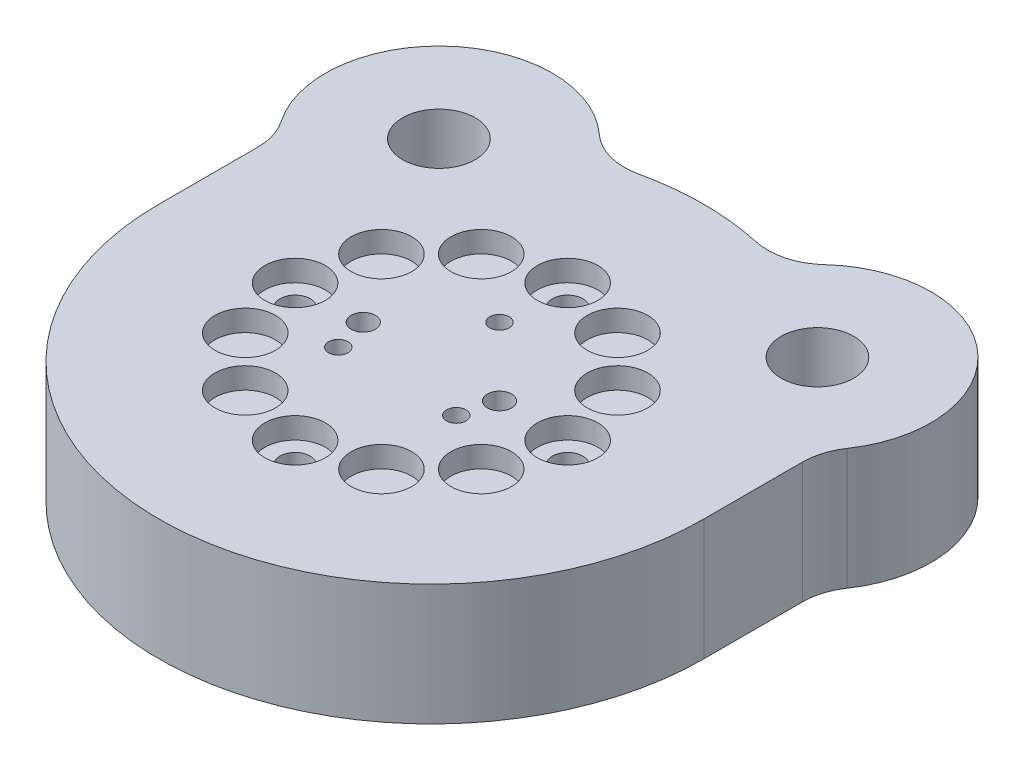
from build123d import *

# Parameters (mm, degrees)
BOSS_EXTRUDE1_DEPTH                                 = 40
FILLET1_R                                           = 20
CUT_EXTRUDE2_REACH                                  = 150.682
SKETCH3_R                                           = 12
SKETCH4_R                                           = 10
CUT_EXTRUDE3_DEPTH                                  = 7
CIRPATTERN1_COUNT                                   = 12
F_10_0_10_DIAMETER_HOLE1_D                          = 10
SKETCH8_R                                           = 8.5
CUT_EXTRUDE4_DEPTH                                  = 23
CBORE_FOR_M6_HEX_SOCKET_HEAD_CAP_SCREW1_D           = 6.4
CBORE_FOR_M6_HEX_SOCKET_HEAD_CAP_SCREW1_CBORE_D     = 11
CBORE_FOR_M6_HEX_SOCKET_HEAD_CAP_SCREW1_CBORE_DEPTH = 6.4
F_8_0MM_DOWEL_HOLE1_D                               = 8


with BuildPart() as part:
    # Sketch1 → Boss-Extrude1 (new body)
    with BuildSketch(Plane(origin=(0, 0, 0), x_dir=(1, 0, 0), z_dir=(0, 1, 0))):
        with BuildLine():
            Line((-90, 0), (-90, 39.504902432))
            ThreePointArc((-90, 39.504902432), (-85.182396525, 94.862332258), (-30.561841884, 84.652075111))
            ThreePointArc((-30.561841884, 84.652075111), (0, 90), (30.561841884, 84.652075111))
            ThreePointArc((30.561841884, 84.652075111), (85.182396525, 94.862332258), (90, 39.504902432))
            Line((90, 39.504902432), (90, 0))
            ThreePointArc((90, 0), (0, -90), (-90, 0))
        make_face()
    extrude(amount=-BOSS_EXTRUDE1_DEPTH)

    # Fillet1
    fillet1_edges = [part.edges().sort_by_distance(p)[0] for p in [
        (30.561841884, -20, -84.652075111),
        (90, -20, -39.504902432),
        (-90, -20, -39.504902432),
        (-30.561841884, -20, -84.652075111),
    ]]
    fillet(fillet1_edges, radius=FILLET1_R)

    # Sketch3 → Cut-Extrude2 (cut, up to next)
    with BuildSketch(Plane(origin=(0, 0, 0), x_dir=(1, 0, 0), z_dir=(0, 1, 0)), mode=Mode.PRIVATE) as cut_extrude2_sk1:
        with Locations(Location((-62.5, 65, 0), (0, 0, 270))):
            Circle(SKETCH3_R)
    cut_extrude2_tool1 = extrude(cut_extrude2_sk1.sketch, amount=-CUT_EXTRUDE2_REACH, mode=Mode.PRIVATE) & part.part
    # Sketch3 → Cut-Extrude2 (cut, up to next)
    with BuildSketch(Plane(origin=(0, 0, 0), x_dir=(1, 0, 0), z_dir=(0, 1, 0)), mode=Mode.PRIVATE) as cut_extrude2_sk2:
        with Locations(Location((62.5, 65, 0), (0, 0, 270))):
            Circle(SKETCH3_R)
    cut_extrude2_tool2 = extrude(cut_extrude2_sk2.sketch, amount=-CUT_EXTRUDE2_REACH, mode=Mode.PRIVATE) & part.part
    add(cut_extrude2_tool1.solids().sort_by_distance((-62.5, 0, -65))[0], mode=Mode.SUBTRACT)
    add(cut_extrude2_tool2.solids().sort_by_distance((62.5, 0, -65))[0], mode=Mode.SUBTRACT)

    # Sketch4 → Cut-Extrude3 (cut)
    with BuildSketch(Plane(origin=(0, 0, 0), x_dir=(1, 0, 0), z_dir=(0, 1, 0))):
        with Locations(Location((0, 45, 0), (0, 0, 270))):
            Circle(SKETCH4_R)
    cut_extrude3 = extrude(amount=-CUT_EXTRUDE3_DEPTH, mode=Mode.SUBTRACT)

    # CirPattern1: Cut-Extrude3 ×12 about axis
    cirpattern1_axis = Axis((0, 0, 0), (0, 1, 0))
    for i in range(1, CIRPATTERN1_COUNT):
        add(cut_extrude3.rotate(cirpattern1_axis, i * 360 / CIRPATTERN1_COUNT), mode=Mode.SUBTRACT)

    # Ø10.0 (10) Diameter Hole1 (through all)
    with Locations(Plane(origin=(0, 0, 0), x_dir=(1, 0, 0), z_dir=(0, 1, 0))):
        with Locations((0, 45), (45, 0), (0, -45), (-45, 0)):
            Hole(F_10_0_10_DIAMETER_HOLE1_D / 2)

    # Sketch8 → Cut-Extrude4 (cut)
    with BuildSketch(Plane.XZ.offset(40)):
        with Locations(Location((0, 45, 0), (0, 0, 270))):
            Circle(SKETCH8_R)
        with Locations(Location((45, 0, 0), (0, 0, 270))):
            Circle(SKETCH8_R)
        with Locations(Location((0, -45, 0), (0, 0, 270))):
            Circle(SKETCH8_R)
        with Locations(Location((-45, 0, 0), (0, 0, 270))):
            Circle(SKETCH8_R)
    extrude(amount=-CUT_EXTRUDE4_DEPTH, mode=Mode.SUBTRACT)

    # CBORE for M6 Hex Socket Head Cap Screw1 (through all)
    with Locations(Plane(origin=(0, -40, 0), x_dir=(-1, 0, 0), z_dir=(0, -1, 0))):
        with Locations((0, 22.5), (-19.485571585, -11.25), (19.485571585, -11.25)):
            CounterBoreHole(CBORE_FOR_M6_HEX_SOCKET_HEAD_CAP_SCREW1_D / 2, CBORE_FOR_M6_HEX_SOCKET_HEAD_CAP_SCREW1_CBORE_D / 2, CBORE_FOR_M6_HEX_SOCKET_HEAD_CAP_SCREW1_CBORE_DEPTH)

    # Ø8.0mm Dowel Hole1 (through all)
    with Locations(Plane(origin=(0, 0, 0), x_dir=(1, 0, 0), z_dir=(0, 1, 0))):
        with Locations((-22.5, 0), (22.5, 0)):
            Hole(F_8_0MM_DOWEL_HOLE1_D / 2)


solid = part.part
